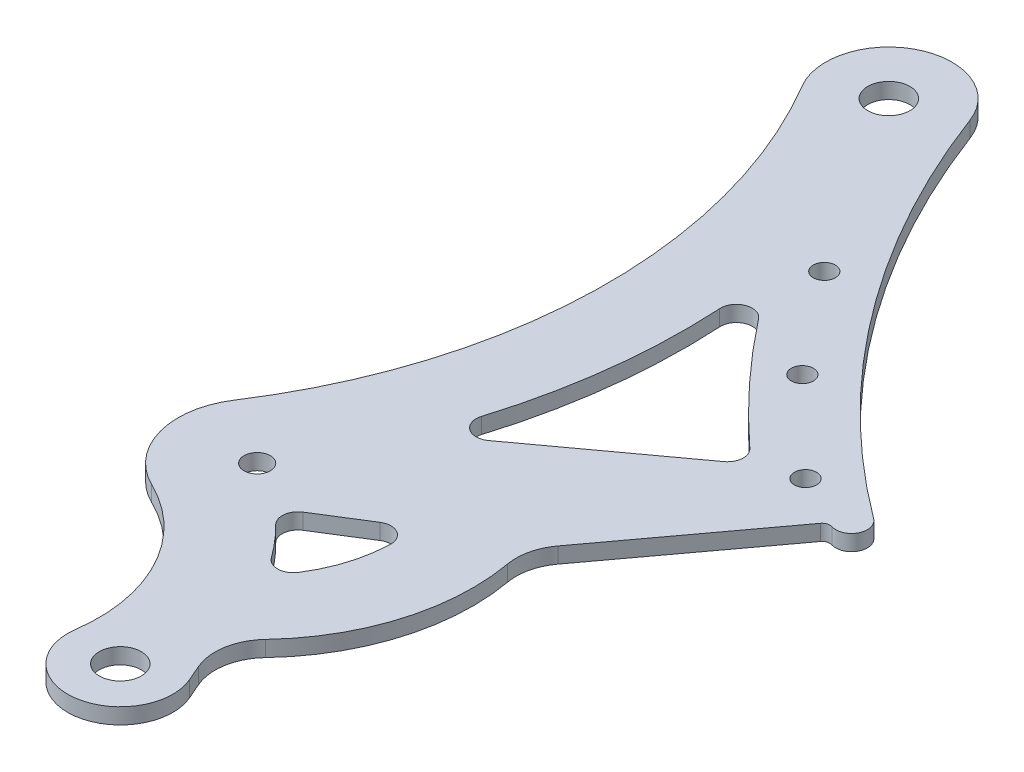
from build123d import *

# Parameters (mm, degrees)
SKETCH1_R           = 4
SKETCH1_R_2         = 2.5
BOSS_EXTRUDE2_DEPTH = 3
CUT_EXTRUDE2_REACH  = 186.619
SKETCH2_R           = 4
CUT_EXTRUDE3_REACH  = 186.619
SKETCH3_R           = 2.1


with BuildPart() as part:
    # Sketch1 → Boss-Extrude2 (new body)
    with BuildSketch(Plane(origin=(0, 0, 0), x_dir=(1, 0, 0), z_dir=(0, 1, 0))):
        with BuildLine():
            Line((9.170700563, 3.987261114), (7.876862883, 6.963087778))
            ThreePointArc((7.876862883, 6.963087778), (7.198186925, 12.679447551), (9.783335319, 17.822829502))
            ThreePointArc((9.783335319, 17.822829502), (19.286109016, 34.269627525), (20.356745206, 53.234163146))
            ThreePointArc((20.356745206, 53.234163146), (20.462846426, 57.276901224), (22.161434095, 60.947022282))
            Line((22.161434095, 60.947022282), (43.375248586, 89.614346273))
            ThreePointArc((43.375248586, 89.614346273), (44.111659282, 90.146760278), (45.020325467, 90.156307579))
            ThreePointArc((45.020325467, 90.156307579), (48.577517121, 91.673723777), (47.683482049, 95.43628483))
            ThreePointArc((47.683482049, 95.43628483), (14.052723286, 128.748405766), (-8.766929777, 170.221153086))
            ThreePointArc((-8.766929777, 170.221153086), (-25.192986973, 176.818173889), (-30.319391627, 159.875446429))
            ThreePointArc((-30.319391627, 159.875446429), (-16.336845375, 106.715190551), (-32.562737633, 54.196195652))
            ThreePointArc((-32.562737633, 54.196195652), (-34.453402431, 41.987624374), (-26.539917992, 32.500760293))
            ThreePointArc((-26.539917992, 32.500760293), (-13.161486595, 19.643005303), (-9.904938494, 1.37557022))
            ThreePointArc((-9.904938494, 1.37557022), (1.356469191, -9.907572424), (9.170700563, 3.987261114))
        make_face()
        with Locations(Location((0, 0, 0), (0, 0, 270))):
            Circle(SKETCH1_R, mode=Mode.SUBTRACT)
        with Locations(Location((-20, 46, 0), (0, 0, 270))):
            Circle(SKETCH1_R_2, mode=Mode.SUBTRACT)
    extrude(amount=BOSS_EXTRUDE2_DEPTH)

    # Sketch2 → Cut-Extrude2 (cut, up to next)
    with BuildSketch(Plane(origin=(0, 3, 0), x_dir=(1, 0, 0), z_dir=(0, 1, 0)), mode=Mode.PRIVATE) as cut_extrude2_sk1:
        with Locations(Location((-20, 166, 0), (0, 0, 270))):
            Circle(SKETCH2_R)
    cut_extrude2_tool1 = extrude(cut_extrude2_sk1.sketch, amount=-CUT_EXTRUDE2_REACH, mode=Mode.PRIVATE) & part.part
    # Sketch2 → Cut-Extrude2 (cut, up to next)
    with BuildSketch(Plane(origin=(0, 3, 0), x_dir=(1, 0, 0), z_dir=(0, 1, 0)), mode=Mode.PRIVATE) as cut_extrude2_sk2:
        with BuildLine():
            Line((24.08650635, 90.617794829), (-1.761817511, 71.71243196))
            ThreePointArc((-1.761817511, 71.71243196), (-5.273300355, 71.690348613), (-6.400182005, 75.01617741))
            ThreePointArc((-6.400182005, 75.01617741), (-2.152471882, 94.978495294), (-1.500425627, 115.37731909))
            ThreePointArc((-1.500425627, 115.37731909), (0.438343778, 118.355781743), (3.85956825, 117.393861946))
            ThreePointArc((3.85956825, 117.393861946), (13.636229053, 105.89490145), (24.339781746, 95.253325031))
            ThreePointArc((24.339781746, 95.253325031), (25.310999303, 92.875575481), (24.08650635, 90.617794829))
        make_face()
    cut_extrude2_tool2 = extrude(cut_extrude2_sk2.sketch, amount=-CUT_EXTRUDE2_REACH, mode=Mode.PRIVATE) & part.part
    # Sketch2 → Cut-Extrude2 (cut, up to next)
    with BuildSketch(Plane(origin=(0, 3, 0), x_dir=(1, 0, 0), z_dir=(0, 1, 0)), mode=Mode.PRIVATE) as cut_extrude2_sk3:
        with BuildLine():
            Line((1.399941693, 47.961192116), (-7.607238393, 42.3183015))
            ThreePointArc((-7.607238393, 42.3183015), (-8.997062251, 40.099202055), (-8.114849087, 37.633900322))
            ThreePointArc((-8.114849087, 37.633900322), (-5.481535576, 34.820910528), (-3.098522666, 31.792957242))
            ThreePointArc((-3.098522666, 31.792957242), (-0.586190052, 30.546672377), (1.858342535, 31.921191043))
            ThreePointArc((1.858342535, 31.921191043), (4.848412053, 38.347783431), (5.991700338, 45.343103105))
            ThreePointArc((5.991700338, 45.343103105), (4.478604072, 48.025038621), (1.399941693, 47.961192116))
        make_face()
    cut_extrude2_tool3 = extrude(cut_extrude2_sk3.sketch, amount=-CUT_EXTRUDE2_REACH, mode=Mode.PRIVATE) & part.part
    add(cut_extrude2_tool1.solids().sort_by_distance((-20, 3, -166))[0], mode=Mode.SUBTRACT)
    add(cut_extrude2_tool2.solids().sort_by_distance((6.92649, 3, -93.946856))[0], mode=Mode.SUBTRACT)
    add(cut_extrude2_tool3.solids().sort_by_distance((-0.710411, 3, -39.721946))[0], mode=Mode.SUBTRACT)

    # Sketch3 → Cut-Extrude3 (cut, up to next)
    with BuildSketch(Plane(origin=(0, 3, 0), x_dir=(1, 0, 0), z_dir=(0, 1, 0)), mode=Mode.PRIVATE) as cut_extrude3_sk1:
        with Locations(Location((2.309703224, 131.433631836, 0), (0, 0, 270))):
            Circle(SKETCH3_R)
    cut_extrude3_tool1 = extrude(cut_extrude3_sk1.sketch, amount=-CUT_EXTRUDE3_REACH, mode=Mode.PRIVATE) & part.part
    # Sketch3 → Cut-Extrude3 (cut, up to next)
    with BuildSketch(Plane(origin=(0, 3, 0), x_dir=(1, 0, 0), z_dir=(0, 1, 0)), mode=Mode.PRIVATE) as cut_extrude3_sk2:
        with Locations(Location((34.609964816, 95.56055708, 0), (0, 0, 270))):
            Circle(SKETCH3_R)
    cut_extrude3_tool2 = extrude(cut_extrude3_sk2.sketch, amount=-CUT_EXTRUDE3_REACH, mode=Mode.PRIVATE) & part.part
    # Sketch3 → Cut-Extrude3 (cut, up to next)
    with BuildSketch(Plane(origin=(0, 3, 0), x_dir=(1, 0, 0), z_dir=(0, 1, 0)), mode=Mode.PRIVATE) as cut_extrude3_sk3:
        with Locations(Location((17.205589144, 112.367767299, 0), (0, 0, 270))):
            Circle(SKETCH3_R)
    cut_extrude3_tool3 = extrude(cut_extrude3_sk3.sketch, amount=-CUT_EXTRUDE3_REACH, mode=Mode.PRIVATE) & part.part
    add(cut_extrude3_tool1.solids().sort_by_distance((2.309703, 3, -131.433632))[0], mode=Mode.SUBTRACT)
    add(cut_extrude3_tool2.solids().sort_by_distance((34.609965, 3, -95.560557))[0], mode=Mode.SUBTRACT)
    add(cut_extrude3_tool3.solids().sort_by_distance((17.205589, 3, -112.367767))[0], mode=Mode.SUBTRACT)


solid = part.part
